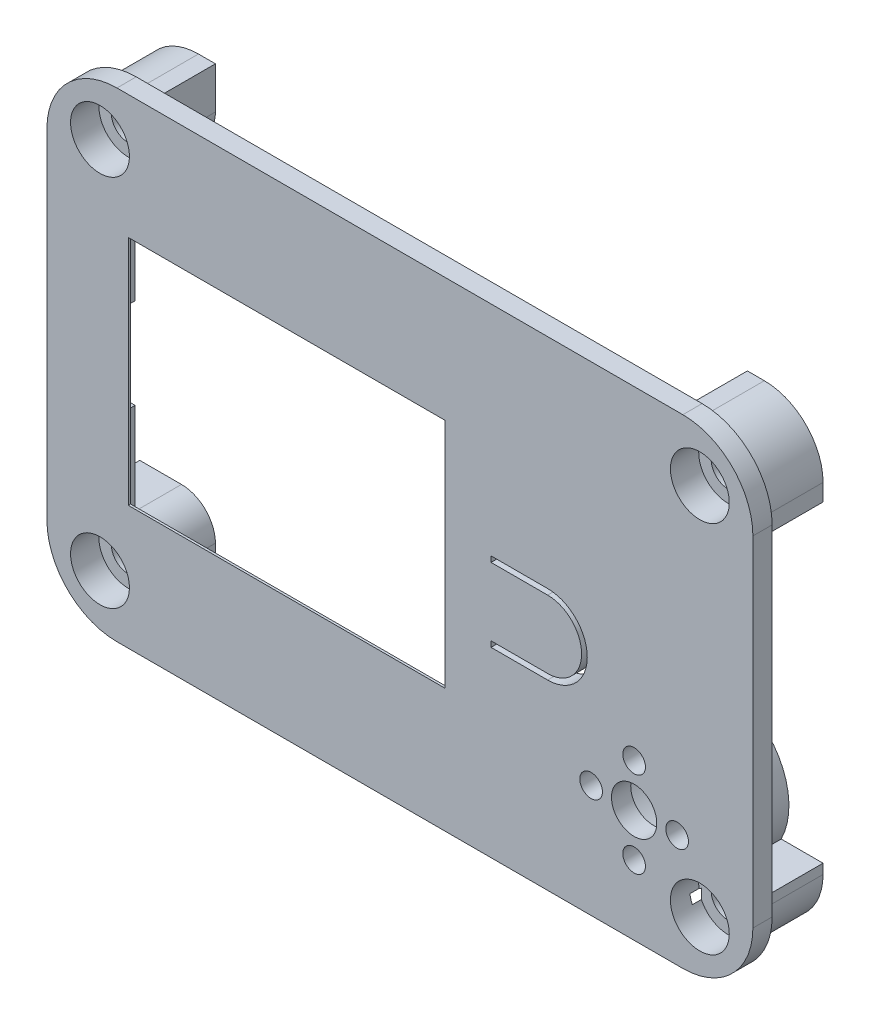
from build123d import *
from build123d.topology import SkipClean

# Parameters (mm, degrees)
SKETCH_1_R          = 1.50000254
EXTRUDE_1_DEPTH     = 1.5
EXTRUDE_START       = 5.4999492
SKETCH_2_R          = 5.479431536
EXTRUDE_2_DEPTH     = 5.4999492
SKETCH_3_R          = 2
SKETCH_3_R_2        = 1
CUT_EXTRUDE_1_DEPTH = 1.5
SKETCH_4_W          = 28
SKETCH_4_H          = 20.5
CUT_EXTRUDE_2_DEPTH = 1.5
SKETCH_5_R          = 1.50000254
EXTRUDE_3_DEPTH     = 5.4999492
SKETCH_7_W          = 30.2
SKETCH_7_H          = 22.7
CUT_EXTRUDE_3_DEPTH = 1.5
SKETCH_8_R          = 1.517681864
EXTRUDE_5_DEPTH     = 0.524949197
SKETCH_10_W         = 30.2
SKETCH_10_H         = 27.8
CUT_EXTRUDE_5_DEPTH = 1.1
SKETCH_6_R          = 1
SKETCH_6_R_2        = 2
SKETCH_6_W          = 28
SKETCH_6_H          = 20.5
EXTRUDE_4_DEPTH     = 0.2
CUT_EXTRUDE_4_DEPTH = 14.2
SKETCH_13_R         = 1.517681864
CUT_EXTRUDE_8_DEPTH = 0.7
SKETCH_11_R         = 1.50000254
CUT_EXTRUDE_6_DEPTH = 1.7
SKETCH_12_R         = 2.6
CUT_EXTRUDE_7_DEPTH = 2.5
SKETCH_14_W         = 1.6
SKETCH_14_H         = 8
CUT_EXTRUDE_9_DEPTH = 1.5


with BuildPart() as part:
    # 草图1 → 凸台-拉伸1 (new body)
    with BuildSketch(Plane.XY.offset(7.1)):
        with BuildLine():
            Line((-1.187299975, -2.77233639), (-1.187299975, -32.77239481))
            ThreePointArc((-1.187299975, -32.77239481), (0.624921207, -37.147483764), (5.00001016, -38.959704945))
            Line((5.00001016, -38.959704945), (55.00010922, -38.959704945))
            ThreePointArc((55.00010922, -38.959704945), (59.375198174, -37.147483764), (61.187419355, -32.77239481))
            Line((61.187419355, -32.77239481), (61.187419355, -2.77233639))
            ThreePointArc((61.187419355, -2.77233639), (59.375198174, 1.602752563), (55.00010922, 3.414973745))
            Line((55.00010922, 3.414973745), (5.00001016, 3.414973745))
            ThreePointArc((5.00001016, 3.414973745), (0.624921207, 1.602752563), (-1.187299975, -2.77233639))
        make_face()
        with Locations((56.50012446, -1.27234401)):
            Circle(SKETCH_1_R, mode=Mode.SUBTRACT)
        with Locations((56.50011176, -34.27239989)):
            Circle(SKETCH_1_R, mode=Mode.SUBTRACT)
        with Locations((3.50000762, -34.27239989)):
            Circle(SKETCH_1_R, mode=Mode.SUBTRACT)
        with Locations((3.50002286, -1.27236433)):
            Circle(SKETCH_1_R, mode=Mode.SUBTRACT)
    extrude(amount=EXTRUDE_1_DEPTH)

    # 草图2 → 凸台-拉伸2 (add)
    with BuildSketch(Plane(origin=(0, 0, 7.1), x_dir=(-1, 0, 0), z_dir=(0, 0, -1)).offset(EXTRUDE_START)):
        with BuildLine():
            ThreePointArc((-55.085589107, -33.773267358), (-45.891997384, -24.658833945), (-55.864584942, -32.913682376))
            ThreePointArc((-55.864584942, -32.913682376), (-55.388627485, -33.265121217), (-55.085589107, -33.773267358))
        make_face()
        with Locations((-50.693180097, -29.009888712)):
            Circle(SKETCH_2_R, mode=Mode.SUBTRACT)
    extrude(amount=-EXTRUDE_2_DEPTH)

    # 草图3 → 切除-拉伸1 (cut)
    with BuildSketch(Plane(origin=(0, 0, 7.1), x_dir=(-1, 0, 0), z_dir=(0, 0, -1))):
        with Locations((-50.693180097, -29.009888712)):
            Circle(SKETCH_3_R)
        with Locations((-54.493180097, -29.009888712)):
            Circle(SKETCH_3_R_2)
        with Locations((-50.693180097, -25.209888712)):
            Circle(SKETCH_3_R_2)
        with Locations((-46.893180097, -29.009888712)):
            Circle(SKETCH_3_R_2)
        with Locations((-50.693180097, -32.809888712)):
            Circle(SKETCH_3_R_2)
    extrude(amount=-CUT_EXTRUDE_1_DEPTH, mode=Mode.SUBTRACT)

    # 草图4 → 切除-拉伸2 (cut)
    with BuildSketch(Plane.XY.offset(8.6)):
        with Locations((20.00004064, -17.77236687)):
            Rectangle(SKETCH_4_W, SKETCH_4_H)
    extrude(amount=-CUT_EXTRUDE_2_DEPTH, mode=Mode.SUBTRACT)

    # 草图5 → 凸台-拉伸3 (add)
    # profile 1 of 4: a face of its own
    with SkipClean():  # the faces are left unmerged after this step: merging them gives an invalid solid
        with BuildSketch(Plane(origin=(0, 0, 7.1), x_dir=(-1, 0, 0), z_dir=(0, 0, -1)).offset(EXTRUDE_START)):
            with BuildLine():
                Line((-60.187419355, -2.77233639), (-60.187419355, -4.27234401))
                Line((-60.187419355, -4.27234401), (-56.50012446, -4.27234401))
                ThreePointArc((-56.50012446, -4.27234401), (-54.378804117, -3.393664354), (-53.50012446, -1.27234401))
                Line((-53.50012446, -1.27234401), (-53.50012446, 2.414973745))
                Line((-53.50012446, 2.414973745), (-55.00010922, 2.414973745))
                ThreePointArc((-55.00010922, 2.414973745), (-58.668091393, 0.895645782), (-60.187419355, -2.77233639))
            make_face()
            with Locations((-56.50012446, -1.27234401)):
                Circle(SKETCH_5_R, mode=Mode.SUBTRACT)
        # profile 2 of 4: a face of its own
        with BuildSketch(Plane(origin=(0, 0, 7.1), x_dir=(-1, 0, 0), z_dir=(0, 0, -1)).offset(EXTRUDE_START)):
            with BuildLine():
                ThreePointArc((-54.137667628, -34.27239989), (-54.829611494, -32.601899624), (-56.50011176, -31.909955757))
                Line((-56.50011176, -31.909955757), (-60.187419355, -31.909955757))
                Line((-60.187419355, -31.909955757), (-60.187419355, -32.77239481))
                ThreePointArc((-60.187419355, -32.77239481), (-58.668091393, -36.440376982), (-55.00010922, -37.959704945))
                Line((-55.00010922, -37.959704945), (-54.137667628, -37.959704945))
                Line((-54.137667628, -37.959704945), (-54.137667628, -34.27239989))
            make_face()
            with Locations((-56.50011176, -34.27239989)):
                Circle(SKETCH_5_R, mode=Mode.SUBTRACT)
        # profile 3 of 4: a face of its own
        with BuildSketch(Plane(origin=(0, 0, 7.1), x_dir=(-1, 0, 0), z_dir=(0, 0, -1)).offset(EXTRUDE_START)):
            with BuildLine():
                Line((-6.50002286, -34.27236687), (-6.50002286, -37.959704945))
                Line((-6.50002286, -37.959704945), (-5.00001016, -37.959704945))
                ThreePointArc((-5.00001016, -37.959704945), (-1.332027988, -36.440376982), (0.187299975, -32.77239481))
                Line((0.187299975, -32.77239481), (0.187299975, -31.27236687))
                Line((0.187299975, -31.27236687), (-3.50002286, -31.27236687))
                ThreePointArc((-3.50002286, -31.27236687), (-5.621343204, -32.151046526), (-6.50002286, -34.27236687))
            make_face()
            with Locations((-3.50000762, -34.27239989)):
                Circle(SKETCH_5_R, mode=Mode.SUBTRACT)
        # profile 4 of 4: a face of its own
        with BuildSketch(Plane(origin=(0, 0, 7.1), x_dir=(-1, 0, 0), z_dir=(0, 0, -1)).offset(EXTRUDE_START)):
            with BuildLine():
                Line((-5.00001016, 2.414973745), (-6.50002286, 2.414973745))
                Line((-6.50002286, 2.414973745), (-6.50002286, -1.27236433))
                ThreePointArc((-6.50002286, -1.27236433), (-5.621343204, -3.393684674), (-3.50002286, -4.27236433))
                Line((-3.50002286, -4.27236433), (0.187299975, -4.27236433))
                Line((0.187299975, -4.27236433), (0.187299975, -2.77233639))
                ThreePointArc((0.187299975, -2.77233639), (-1.332027988, 0.895645782), (-5.00001016, 2.414973745))
            make_face()
            with Locations((-3.50002286, -1.27236433)):
                Circle(SKETCH_5_R, mode=Mode.SUBTRACT)
        extrude(amount=-EXTRUDE_3_DEPTH)

    # 草图7 → 切除-拉伸3 (cut)
    with SkipClean():  # the faces are left unmerged after this step: merging them gives an invalid solid
        with BuildSketch(Plane.XY.offset(8.6)):
            with Locations((20.00004064, -17.77236687)):
                Rectangle(SKETCH_7_W, SKETCH_7_H)
        extrude(amount=-CUT_EXTRUDE_3_DEPTH, mode=Mode.SUBTRACT)

    # 草图8 → 凸台-拉伸5 (add)
    with SkipClean():  # the faces are left unmerged after this step: merging them gives an invalid solid
        with BuildSketch(Plane(origin=(0, 0, 7.1), x_dir=(-1, 0, 0), z_dir=(0, 0, -1))):
            with Locations(Location((-43.053086106, -19.36236941, 0), (0, 0, 180))):
                Circle(SKETCH_8_R)
        extrude(amount=EXTRUDE_5_DEPTH)

    # 草图10 → 切除-拉伸5 (cut)
    with SkipClean():  # the faces are left unmerged after this step: merging them gives an invalid solid
        with BuildSketch(Plane(origin=(0, 0, 7.1), x_dir=(-1, 0, 0), z_dir=(0, 0, -1))):
            with Locations((-20.00004064, -17.77236687)):
                Rectangle(SKETCH_10_W, SKETCH_10_H)
        extrude(amount=-CUT_EXTRUDE_5_DEPTH, mode=Mode.SUBTRACT)

    # 草图6 → 凸台-拉伸4 (add)
    with BuildSketch(Plane.XY.offset(8.6)):
        with BuildLine():
            Line((-1.187299975, -2.77233639), (-1.187299975, -32.77239481))
            ThreePointArc((-1.187299975, -32.77239481), (0.624921207, -37.147483764), (5.00001016, -38.959704945))
            Line((5.00001016, -38.959704945), (55.00010922, -38.959704945))
            ThreePointArc((55.00010922, -38.959704945), (59.375198174, -37.147483764), (61.187419355, -32.77239481))
            Line((61.187419355, -32.77239481), (61.187419355, -2.77233639))
            ThreePointArc((61.187419355, -2.77233639), (59.375198174, 1.602752563), (55.00010922, 3.414973745))
            Line((55.00010922, 3.414973745), (5.00001016, 3.414973745))
            ThreePointArc((5.00001016, 3.414973745), (0.624921207, 1.602752563), (-1.187299975, -2.77233639))
        make_face()
        with Locations(Location((46.893180097, -29.009888712, 0), (0, 0, 180))):
            Circle(SKETCH_6_R, mode=Mode.SUBTRACT)
        with Locations(Location((50.693180097, -32.809888712, 0), (0, 0, 180))):
            Circle(SKETCH_6_R, mode=Mode.SUBTRACT)
        with Locations(Location((54.493180097, -29.009888712, 0), (0, 0, 180))):
            Circle(SKETCH_6_R, mode=Mode.SUBTRACT)
        with Locations(Location((50.693180097, -29.009888712, 0), (0, 0, 180))):
            Circle(SKETCH_6_R_2, mode=Mode.SUBTRACT)
        with Locations(Location((50.693180097, -25.209888712, 0), (0, 0, 180))):
            Circle(SKETCH_6_R, mode=Mode.SUBTRACT)
        with Locations((20.00004064, -17.77236687)):
            Rectangle(SKETCH_6_W, SKETCH_6_H, mode=Mode.SUBTRACT)
    extrude(amount=EXTRUDE_4_DEPTH)

    # 草图9 → 切除-拉伸4 (cut)
    with BuildSketch(Plane(origin=(0, 0, 7.1), x_dir=(-1, 0, 0), z_dir=(0, 0, -1))):
        with BuildLine():
            Line((-43.053086106, -16.36236941), (-38.053086106, -16.36236941))
            Line((-38.053086106, -16.36236941), (-38.053086106, -15.86236941))
            Line((-38.053086106, -15.86236941), (-43.053086106, -15.86236941))
            ThreePointArc((-43.053086106, -15.86236941), (-46.553086106, -19.36236941), (-43.053086106, -22.86236941))
            Line((-43.053086106, -22.86236941), (-38.053086106, -22.86236941))
            Line((-38.053086106, -22.86236941), (-38.053086106, -22.36236941))
            Line((-38.053086106, -22.36236941), (-43.053086106, -22.36236941))
            ThreePointArc((-43.053086106, -22.36236941), (-46.053086106, -19.36236941), (-43.053086106, -16.36236941))
        make_face()
    extrude(amount=-CUT_EXTRUDE_4_DEPTH, mode=Mode.SUBTRACT)

    # 草图13 → 切除-拉伸8 (cut)
    with BuildSketch(Plane(origin=(0, 0, 7.1), x_dir=(-1, 0, 0), z_dir=(0, 0, -1))):
        with BuildLine():
            Line((-43.053086106, -16.36236941), (-38.053086106, -16.36236941))
            Line((-38.053086106, -16.36236941), (-37.253086106, -16.36236941))
            Line((-37.253086106, -16.36236941), (-37.253086106, -22.36236941))
            Line((-37.253086106, -22.36236941), (-38.053086106, -22.36236941))
            Line((-38.053086106, -22.36236941), (-43.053086106, -22.36236941))
            ThreePointArc((-43.053086106, -22.36236941), (-46.053086106, -19.36236941), (-43.053086106, -16.36236941))
        make_face()
        with Locations(Location((-43.053086106, -19.36236941, 0), (0, 0, 180))):
            Circle(SKETCH_13_R, mode=Mode.SUBTRACT)
    extrude(amount=-CUT_EXTRUDE_8_DEPTH, mode=Mode.SUBTRACT)

    # 草图11 → 切除-拉伸6 (cut)
    with BuildSketch(Plane(origin=(0, 0, 7.1), x_dir=(-1, 0, 0), z_dir=(0, 0, -1))):
        with Locations((-56.50012446, -1.27234401)):
            Circle(SKETCH_11_R)
        with Locations((-3.50002286, -1.27236433)):
            Circle(SKETCH_11_R)
        with Locations((-56.50011176, -34.27239989)):
            Circle(SKETCH_11_R)
        with Locations((-3.50000762, -34.27239989)):
            Circle(SKETCH_11_R)
    extrude(amount=-CUT_EXTRUDE_6_DEPTH, mode=Mode.SUBTRACT)

    # 草图12 → 切除-拉伸7 (cut)
    with BuildSketch(Plane.XY.offset(8.8)):
        with Locations((3.50002286, -1.27236433)):
            Circle(SKETCH_12_R)
        with Locations(Location((56.50009652, -1.27236433, 0), (0, 0, 180))):
            Circle(SKETCH_12_R)
        with Locations((56.50009652, -34.27236687)):
            Circle(SKETCH_12_R)
        with Locations(Location((3.50002286, -34.27236687, 0), (0, 0, 180))):
            Circle(SKETCH_12_R)
    extrude(amount=-CUT_EXTRUDE_7_DEPTH, mode=Mode.SUBTRACT)

    # 草图14 → 切除-拉伸9 (cut)
    with BuildSketch(Plane(origin=(0, 0, 7.1), x_dir=(-1, 0, 0), z_dir=(0, 0, -1))):
        with Locations((-4.90004064, -17.7723656)):
            Rectangle(SKETCH_14_W, SKETCH_14_H)
    extrude(amount=-CUT_EXTRUDE_9_DEPTH, mode=Mode.SUBTRACT)


solid = part.part
